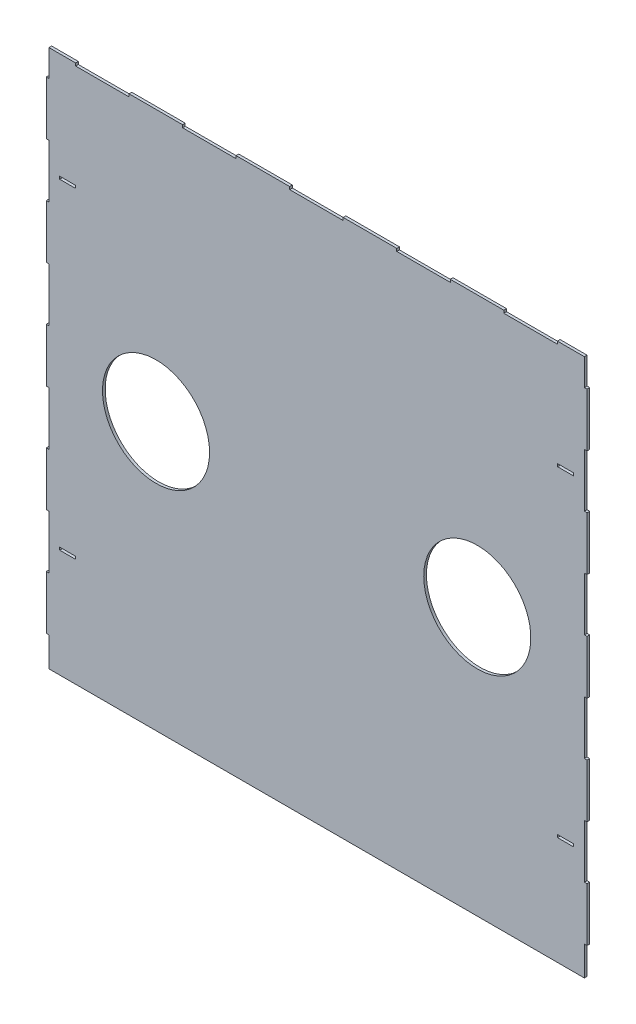
from build123d import *

# Parameters (mm, degrees)
SKETCH1_W           = 15
SKETCH1_H           = 2.5
SKETCH1_R           = 50
BOSS_EXTRUDE1_DEPTH = 2.5


with BuildPart() as part:
    # Sketch1 → Boss-Extrude1 (new body)
    with BuildSketch(Plane.XY):
        Polygon((473.97260274, -110.342465753), (473.97260274, -60.342465753), (476.47260274, -60.342465753), (476.47260274, -10.342465753), (473.97260274, -10.342465753), (473.97260274, 14.657534247), (448.750266435, 14.657534247), (448.750266435, 12.157534247), (398.750266435, 12.157534247), (398.750266435, 14.657534247), (348.750266435, 14.657534247), (348.750266435, 12.157534247), (298.750266435, 12.157534247), (298.750266435, 14.657534247), (248.750266435, 14.657534247), (248.750266435, 12.157534247), (198.750266435, 12.157534247), (198.750266435, 14.657534247), (148.750266435, 14.657534247), (148.750266435, 12.157534247), (98.750266435, 12.157534247), (98.750266435, 14.657534247), (48.750266435, 14.657534247), (48.750266435, 12.157534247), (-1.02739726, 12.157534247), (-1.02739726, 14.657534247), (-26.02739726, 14.657534247), (-26.02739726, -10.342465753), (-28.52739726, -10.342465753), (-28.52739726, -60.342465753), (-26.02739726, -60.342465753), (-26.02739726, -110.342465753), (-28.52739726, -110.342465753), (-28.52739726, -160.342465753), (-26.02739726, -160.342465753), (-26.02739726, -210.342465753), (-28.52739726, -210.342465753), (-28.52739726, -260.342465753), (-26.02739726, -260.342465753), (-26.02739726, -310.342465753), (-28.52739726, -310.342465753), (-28.52739726, -360.342465753), (-26.02739726, -360.342465753), (-26.02739726, -410.342465753), (-28.52739726, -410.342465753), (-28.52739726, -460.342465753), (-26.02739726, -460.342465753), (-26.02739726, -487.842465753), (473.97260274, -487.842465753), (473.97260274, -460.342465753), (476.47260274, -460.342465753), (476.47260274, -410.342465753), (473.97260274, -410.342465753), (473.97260274, -360.342465753), (476.47260274, -360.342465753), (476.47260274, -310.342465753), (473.97260274, -310.342465753), (473.97260274, -260.342465753), (476.47260274, -260.342465753), (476.47260274, -210.342465753), (473.97260274, -210.342465753), (473.97260274, -160.342465753), (476.47260274, -160.342465753), (476.47260274, -110.342465753), align=None)
        with Locations((-8.52739726, -385.592465753)):
            Rectangle(SKETCH1_W, SKETCH1_H, mode=Mode.SUBTRACT)
        with Locations((73.97260274, -237.842465753)):
            Circle(SKETCH1_R, mode=Mode.SUBTRACT)
        with Locations((456.47260274, -385.592465753)):
            Rectangle(SKETCH1_W, SKETCH1_H, mode=Mode.SUBTRACT)
        with Locations((373.97260274, -237.842465753)):
            Circle(SKETCH1_R, mode=Mode.SUBTRACT)
        with Locations((-8.52739726, -85.592465753)):
            Rectangle(SKETCH1_W, SKETCH1_H, mode=Mode.SUBTRACT)
        with Locations((456.47260274, -85.592465753)):
            Rectangle(SKETCH1_W, SKETCH1_H, mode=Mode.SUBTRACT)
    extrude(amount=BOSS_EXTRUDE1_DEPTH)


solid = part.part
